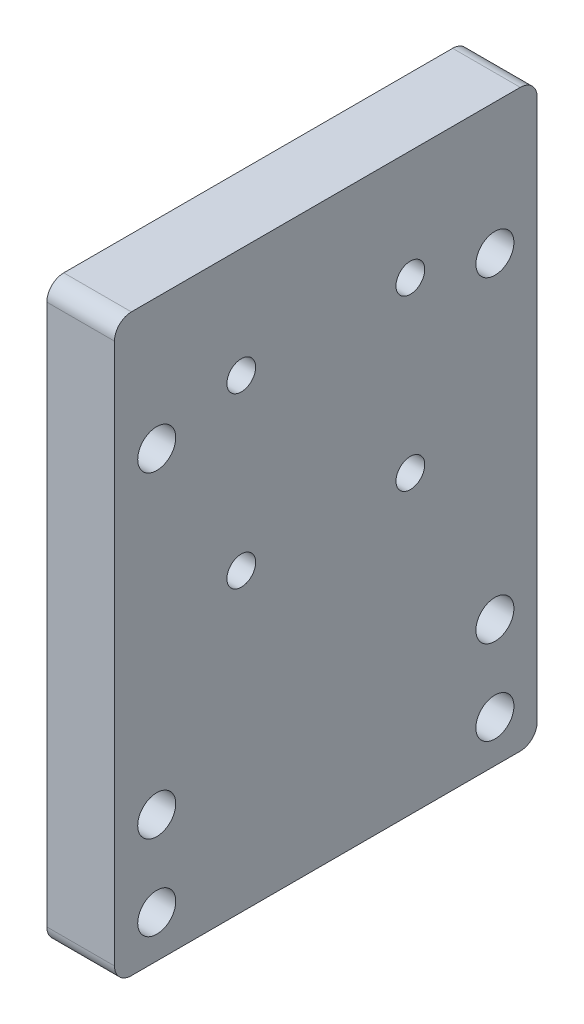
from build123d import *

# Parameters (mm, degrees)
SKETCH1_W                                            = 50
SKETCH1_H                                            = 68
BOSS_EXTRUDE1_DEPTH                                  = 8
M3_CLEARANCE_HOLE1_D                                 = 3.4
CSK_FOR_M4_HEX_SOCKET_COUNTERSUNK_CAP_SC_D           = 4.5
CSK_FOR_M4_HEX_SOCKET_COUNTERSUNK_CAP_SC_CSINK_D     = 8.96
CSK_FOR_M4_HEX_SOCKET_COUNTERSUNK_CAP_SC_CSINK_ANGLE = 90
FILLET1_R                                            = 2
CSK_FOR_M4_HEX_SOCKET_COUNTERSUNK_CA_2_D             = 4.5
CSK_FOR_M4_HEX_SOCKET_COUNTERSUNK_CA_2_CSINK_D       = 8.96
CSK_FOR_M4_HEX_SOCKET_COUNTERSUNK_CA_2_CSINK_ANGLE   = 90


with BuildPart() as part:
    # Sketch1 → Boss-Extrude1 (new body)
    with BuildSketch(Plane(origin=(0, 0, 0), x_dir=(0, 0, -1), z_dir=(1, 0, 0))):
        Rectangle(SKETCH1_W, SKETCH1_H)
    extrude(amount=BOSS_EXTRUDE1_DEPTH)

    # M3 Clearance Hole1 (through all)
    with Locations(Plane(origin=(8, 0, 0), x_dir=(0, 0, -1), z_dir=(1, 0, 0))):
        with Locations((-10, 21), (10, 21), (10, 1), (-10, 1)):
            Hole(M3_CLEARANCE_HOLE1_D / 2)

    # CSK for M4 Hex Socket Countersunk Cap Sc (through all)
    with Locations(Plane.ZY):
        with Locations((-20, -29), (20, -29)):
            CounterSinkHole(CSK_FOR_M4_HEX_SOCKET_COUNTERSUNK_CAP_SC_D / 2, CSK_FOR_M4_HEX_SOCKET_COUNTERSUNK_CAP_SC_CSINK_D / 2, counter_sink_angle=CSK_FOR_M4_HEX_SOCKET_COUNTERSUNK_CAP_SC_CSINK_ANGLE)

    # Fillet1
    fillet1_edges = [part.edges().sort_by_distance(p)[0] for p in [
        (4, -34, -25),
        (4, -34, 25),
        (4, 34, 25),
        (4, 34, -25),
    ]]
    fillet(fillet1_edges, radius=FILLET1_R)

    # CSK for M4 Hex Socket Countersunk Ca 2 (through all)
    with Locations(Plane.ZY):
        with Locations((20, -19), (20, 18.5), (-20, 18.5), (-20, -19)):
            CounterSinkHole(CSK_FOR_M4_HEX_SOCKET_COUNTERSUNK_CA_2_D / 2, CSK_FOR_M4_HEX_SOCKET_COUNTERSUNK_CA_2_CSINK_D / 2, counter_sink_angle=CSK_FOR_M4_HEX_SOCKET_COUNTERSUNK_CA_2_CSINK_ANGLE)


solid = part.part
